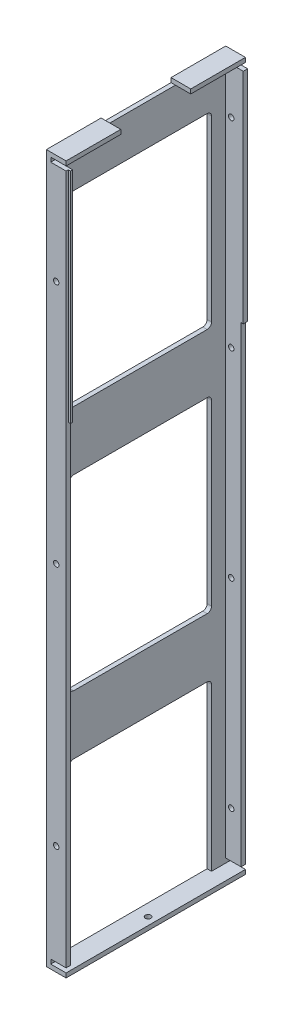
from build123d import *

# Parameters (mm, degrees)
SKETCH1_W                                     = 82
SKETCH1_H                                     = 323.5
BASE_EXTRUSION_DEPTH                          = 2
ACCESS_PORTS_DEPTH                            = 167.877387623
SKETCH4_W                                     = 82
SKETCH4_H                                     = 323.5
SKETCH4_W_2                                   = 78
SKETCH4_H_2                                   = 319.5
CORNER_RAIL_MOUNTS_DEPTH                      = 7
M3X0_5_TAPPED_HOLE_FOR_END_D                  = 2.5
M3X0_5_TAPPED_HOLE_FOR_END_DEPTH              = 2
SKETCH14_W                                    = 9
SKETCH14_H                                    = 32
ANTENNA_CUTOUT_DEPTH                          = 2
SKETCH15_W                                    = 2
SKETCH15_H                                    = 2
SLITS_IN_CORNERS_DEPTH                        = 7
M3X0_5_TAPPED_HOLES_FOR_RAILS_D               = 2.5
M3X0_5_TAPPED_HOLES_FOR_RAILS_DEPTH           = 2
M3X0_5_TAPPED_HOLES_FOR_RAILS_ON_FACE_2_D     = 2.5
M3X0_5_TAPPED_HOLES_FOR_RAILS_ON_FACE_2_DEPTH = 2
SKETCH17_W                                    = 2
SKETCH17_H                                    = 100
SKETCH17_W_2                                  = 1
SUPPORT_FOR_PAYLOAD_DEPTH                     = 1


with BuildPart() as part:
    # Sketch1 → Base Extrusion (new body)
    with BuildSketch(Plane(origin=(0, 0, 0), x_dir=(0, 0, -1), z_dir=(1, 0, 0))):
        Rectangle(SKETCH1_W, SKETCH1_H)
    extrude(amount=BASE_EXTRUSION_DEPTH)

    # Sketch8 → Access Ports (cut, through all)
    with BuildSketch(Plane(origin=(2, 0, 0), x_dir=(0, 0, -1), z_dir=(1, 0, 0))):
        with BuildLine():
            Line((-30.5, 55.75), (30.5, 55.75))
            ThreePointArc((30.5, 55.75), (31.914213562, 56.335786438), (32.5, 57.75))
            Line((32.5, 57.75), (32.5, 139.25))
            ThreePointArc((32.5, 139.25), (31.914213562, 140.664213562), (30.5, 141.25))
            Line((30.5, 141.25), (-30.5, 141.25))
            ThreePointArc((-30.5, 141.25), (-31.914213562, 140.664213562), (-32.5, 139.25))
            Line((-32.5, 139.25), (-32.5, 57.75))
            ThreePointArc((-32.5, 57.75), (-31.914213562, 56.335786438), (-30.5, 55.75))
        make_face()
        with BuildLine():
            Line((-30.5, -56.75), (30.5, -56.75))
            ThreePointArc((30.5, -56.75), (31.914213562, -56.164213562), (32.5, -54.75))
            Line((32.5, -54.75), (32.5, 26.75))
            ThreePointArc((32.5, 26.75), (31.914213562, 28.164213562), (30.5, 28.75))
            Line((30.5, 28.75), (-30.5, 28.75))
            ThreePointArc((-30.5, 28.75), (-31.914213562, 28.164213562), (-32.5, 26.75))
            Line((-32.5, 26.75), (-32.5, -54.75))
            ThreePointArc((-32.5, -54.75), (-31.914213562, -56.164213562), (-30.5, -56.75))
        make_face()
        with BuildLine():
            Line((-32.5, -159.75), (32.5, -159.75))
            Line((32.5, -159.75), (32.5, -85.75))
            ThreePointArc((32.5, -85.75), (31.914213562, -84.335786438), (30.5, -83.75))
            Line((30.5, -83.75), (-30.5, -83.75))
            ThreePointArc((-30.5, -83.75), (-31.914213562, -84.335786438), (-32.5, -85.75))
            Line((-32.5, -85.75), (-32.5, -159.75))
        make_face()
    extrude(amount=-ACCESS_PORTS_DEPTH, mode=Mode.SUBTRACT)

    # Sketch4 → Corner Rail Mounts (add)
    with BuildSketch(Plane(origin=(2, 0, 0), x_dir=(0, 0, -1), z_dir=(1, 0, 0))):
        Rectangle(SKETCH4_W, SKETCH4_H)
        Rectangle(SKETCH4_W_2, SKETCH4_H_2, mode=Mode.SUBTRACT)
    extrude(amount=CORNER_RAIL_MOUNTS_DEPTH)

    # M3x0.5 Tapped Hole For End
    with Locations(Plane.XZ.offset(161.75)):
        with Locations((5.5, 0)):
            Hole(M3X0_5_TAPPED_HOLE_FOR_END_D / 2, depth=M3X0_5_TAPPED_HOLE_FOR_END_DEPTH)

    # Sketch14 → Antenna Cutout (cut)
    with BuildSketch(Plane(origin=(0, 161.75, 0), x_dir=(1, 0, 0), z_dir=(0, 1, 0))):
        with Locations((4.5, 0)):
            Rectangle(SKETCH14_W, SKETCH14_H)
    extrude(amount=-ANTENNA_CUTOUT_DEPTH, mode=Mode.SUBTRACT)

    # Sketch15 → Slits In Corners (cut)
    with BuildSketch(Plane(origin=(9, 0, 0), x_dir=(0, 0, -1), z_dir=(1, 0, 0))):
        with Locations((-40, -158.75)):
            Rectangle(SKETCH15_W, SKETCH15_H)
        with Locations((40, -158.75)):
            Rectangle(SKETCH15_W, SKETCH15_H)
        with Locations((40, 158.75)):
            Rectangle(SKETCH15_W, SKETCH15_H)
        with Locations((-40, 158.75)):
            Rectangle(SKETCH15_W, SKETCH15_H)
    extrude(amount=-SLITS_IN_CORNERS_DEPTH, mode=Mode.SUBTRACT)

    # M3x0.5 Tapped Holes For Rails
    with Locations(Plane(origin=(4.5, 136.75, -41), x_dir=(-1, 0, 0), z_dir=(0, 0, -1))):
        with Locations((0, 0), (0, -91.166666667), (0, -182.333333333), (0, -273.5)):
            Hole(M3X0_5_TAPPED_HOLES_FOR_RAILS_D / 2, depth=M3X0_5_TAPPED_HOLES_FOR_RAILS_DEPTH)

    # M3x0.5 Tapped Holes For Rails on face 2
    with Locations(Plane(origin=(4.5, 111.75, 41), x_dir=(1, 0, 0), z_dir=(0, 0, 1))):
        with Locations((0, 0), (0, -111.75), (0, -223.5)):
            Hole(M3X0_5_TAPPED_HOLES_FOR_RAILS_ON_FACE_2_D / 2, depth=M3X0_5_TAPPED_HOLES_FOR_RAILS_ON_FACE_2_DEPTH)

    # Sketch17 → Support For Payload (add)
    with BuildSketch(Plane(origin=(9, 0, 0), x_dir=(0, 0, -1), z_dir=(1, 0, 0))):
        with Locations((40, 107.75)):
            Rectangle(SKETCH17_W, SKETCH17_H)
        with Locations((-39.5, 107.75)):
            Rectangle(SKETCH17_W_2, SKETCH17_H)
    extrude(amount=SUPPORT_FOR_PAYLOAD_DEPTH)


solid = part.part
